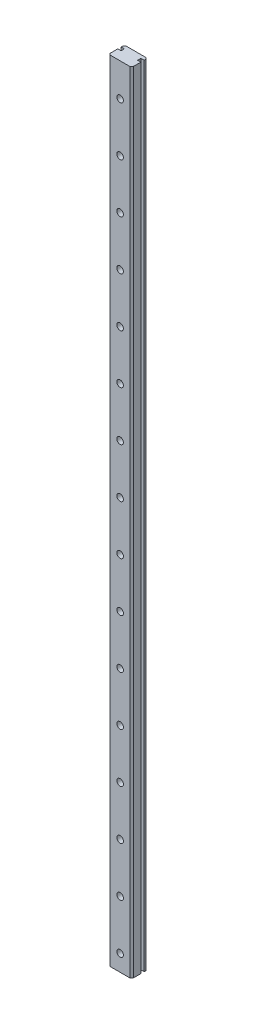
from build123d import *

# Parameters (mm, degrees)
EXTRUDE_1_DEPTH     = 240
SKETCH_2_R          = 1
CUT_EXTRUDE_1_DEPTH = 10
CHAMFER_1_SIZE      = 0.5
SKETCH_3_R          = 2.383304988
CUT_EXTRUDE_2_DEPTH = 1


with BuildPart() as part:
    # 草图1 → 凸台-拉伸1 (new body)
    with BuildSketch(Plane(origin=(0, 0, 0), x_dir=(1, 0, 0), z_dir=(0, 1, 0))):
        Polygon((-3.5, 0.4), (-3.5, -2.4), (3.5, -2.4), (3.5, 0.4), (2.5, 0.4), (2.5, 1.4), (3.5, 1.4), (3.5, 2.4), (-3.5, 2.4), (-3.5, 1.4), (-2.5, 1.4), (-2.5, 0.4), align=None)
    extrude(amount=EXTRUDE_1_DEPTH)

    # 草图2 → 切除-拉伸1 (cut)
    with BuildSketch(Plane(origin=(0, 0, -2.4), x_dir=(-1, 0, 0), z_dir=(0, 0, -1))):
        with Locations((0, 5)):
            Circle(SKETCH_2_R)
        with Locations((0, 20)):
            Circle(SKETCH_2_R)
        with Locations((0, 35)):
            Circle(SKETCH_2_R)
        with Locations((0, 50)):
            Circle(SKETCH_2_R)
        with Locations((0, 65)):
            Circle(SKETCH_2_R)
        with Locations((0, 80)):
            Circle(SKETCH_2_R)
        with Locations((0, 95)):
            Circle(SKETCH_2_R)
        with Locations((0, 110)):
            Circle(SKETCH_2_R)
        with Locations((0, 125)):
            Circle(SKETCH_2_R)
        with Locations((0, 140)):
            Circle(SKETCH_2_R)
        with Locations((0, 155)):
            Circle(SKETCH_2_R)
        with Locations((0, 170)):
            Circle(SKETCH_2_R)
        with Locations((0, 185)):
            Circle(SKETCH_2_R)
        with Locations((0, 200)):
            Circle(SKETCH_2_R)
        with Locations((0, 215)):
            Circle(SKETCH_2_R)
        with Locations((0, 230)):
            Circle(SKETCH_2_R)
    extrude(amount=-CUT_EXTRUDE_1_DEPTH, mode=Mode.SUBTRACT)

    # 倒角1
    chamfer_1_edges = [part.edges().sort_by_distance(p)[0] for p in [
        (-3.5, 120, -2.4),
        (3.5, 120, -2.4),
        (3.5, 120, 2.4),
        (-3.5, 120, 2.4),
    ]]
    chamfer(chamfer_1_edges, length=CHAMFER_1_SIZE)

    # 草图3 → 切除-拉伸2 (cut)
    with BuildSketch(Plane(origin=(0, 0, -2.4), x_dir=(-1, 0, 0), z_dir=(0, 0, -1))):
        with Locations((0, 5)):
            Circle(SKETCH_3_R)
        with Locations((0, 20)):
            Circle(SKETCH_3_R)
        with Locations((0, 35)):
            Circle(SKETCH_3_R)
        with Locations((0, 50)):
            Circle(SKETCH_3_R)
        with Locations((0, 65)):
            Circle(SKETCH_3_R)
        with Locations((0, 80)):
            Circle(SKETCH_3_R)
        with Locations((0, 95)):
            Circle(SKETCH_3_R)
        with Locations((0, 110)):
            Circle(SKETCH_3_R)
        with Locations((0, 125)):
            Circle(SKETCH_3_R)
        with Locations((0, 140)):
            Circle(SKETCH_3_R)
        with Locations((0, 155)):
            Circle(SKETCH_3_R)
        with Locations((0, 170)):
            Circle(SKETCH_3_R)
        with Locations((0, 185)):
            Circle(SKETCH_3_R)
        with Locations((0, 200)):
            Circle(SKETCH_3_R)
        with Locations((0, 215)):
            Circle(SKETCH_3_R)
        with Locations((0, 230)):
            Circle(SKETCH_3_R)
    extrude(amount=-CUT_EXTRUDE_2_DEPTH, mode=Mode.SUBTRACT)


solid = part.part
